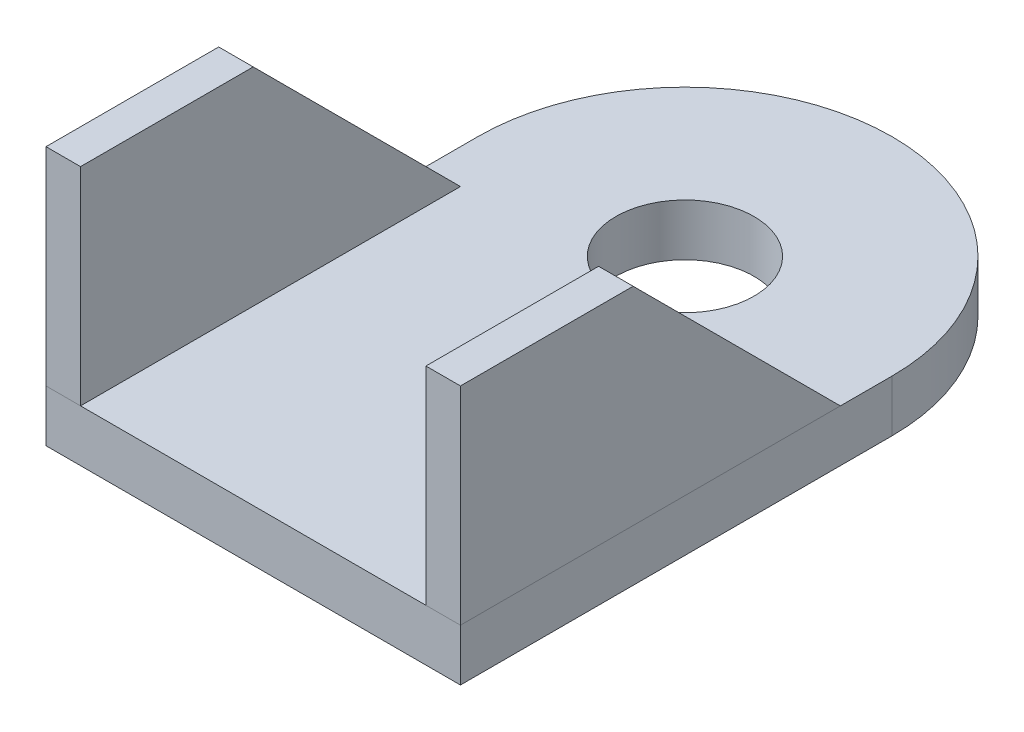
from build123d import *

# Parameters (mm, degrees)
SKETCH_1_R          = 12
SKETCH_1_R_2        = 4
EXTRUDE_1_DEPTH     = 3
EXTRUDE_2_DEPTH     = 2
BOSS_EXTRUDE1_START = -24
BOSS_EXTRUDE1_DEPTH = 2


with BuildPart() as part:
    # 草图1 → 凸台-拉伸1 (new body)
    # profile 1 of 2: a face of its own
    with BuildSketch(Plane(origin=(0, 0, 0), x_dir=(1, 0, 0), z_dir=(0, 1, 0))):
        Circle(SKETCH_1_R)
        with Locations(Location((0, 0, 0), (0, 0, 270))):
            Circle(SKETCH_1_R_2, mode=Mode.SUBTRACT)
    # profile 2 of 2: a face of its own
    with BuildSketch(Plane(origin=(0, 0, 0), x_dir=(1, 0, 0), z_dir=(0, 1, 0))):
        with BuildLine():
            ThreePointArc((12, 0), (0, -12), (-12, 0))
            Line((-12, 0), (-12, -25))
            Line((-12, -25), (12, -25))
            Line((12, -25), (12, 0))
        make_face()
    extrude(amount=EXTRUDE_1_DEPTH)


with BuildPart() as body_2:
    # 草图3 → 凸台-拉伸2 (new body)
    with BuildSketch(Plane(origin=(12, 0, 0), x_dir=(0, 0, -1), z_dir=(1, 0, 0))):
        Polygon((-25, 3), (-25, 15), (-15, 15), (-3, 3), align=None)
    extrude(amount=-EXTRUDE_2_DEPTH)


with BuildPart() as body_3:
    # 草图3<2> → Boss-Extrude1 (new body)
    with BuildSketch(Plane(origin=(12, 0, 0), x_dir=(0, 0, -1), z_dir=(1, 0, 0)).offset(BOSS_EXTRUDE1_START)):
        Polygon((-25, 3), (-25, 15), (-15, 15), (-3, 3), align=None)
    extrude(amount=BOSS_EXTRUDE1_DEPTH)


solid = Compound([part.part, body_2.part, body_3.part])
